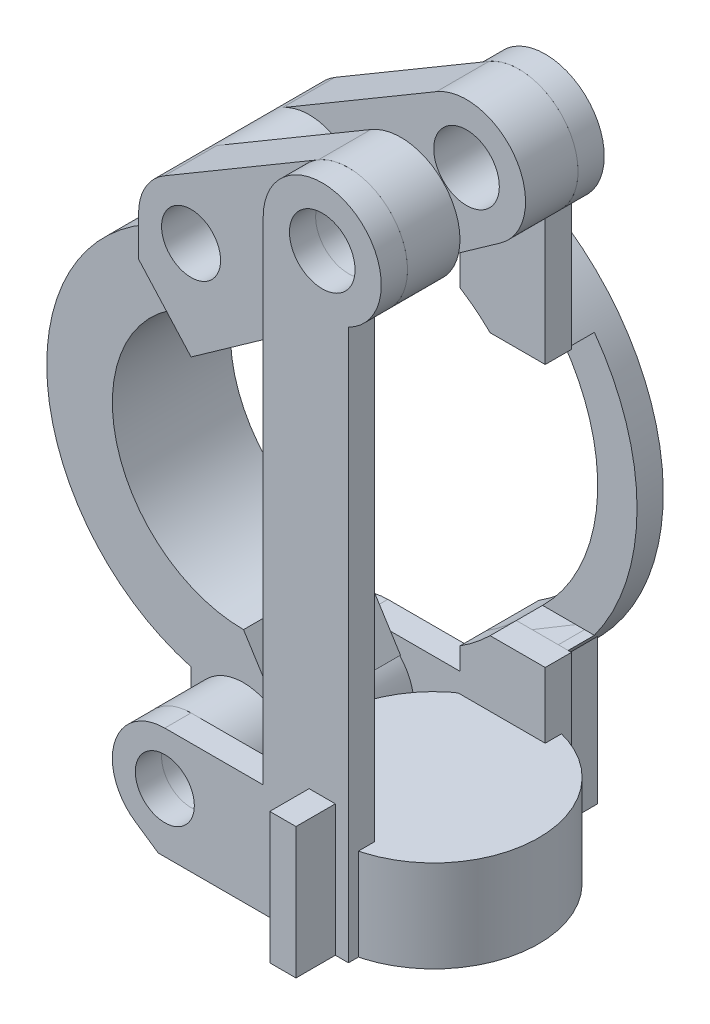
from build123d import *

# Parameters (mm, degrees)
SKETCH_1_R          = 2.25
SKETCH_1_R_2        = 2.5
EXTRUDE_1_DEPTH     = 4
SKETCH_2_R          = 2.25
EXTRUDE_2_DEPTH     = 5
SKETCH_5_R          = 2.25
SKETCH_5_R_2        = 4.5
SKETCH_5_R_3        = 2.5
EXTRUDE_3_DEPTH     = 4
SKETCH_6_R          = 2.5
SKETCH_6_R_2        = 2.25
EXTRUDE_6_DEPTH     = 2
SKETCH_6_3_R        = 4
SKETCH_6_3_R_2      = 2.25
EXTRUDE_8_DEPTH     = 4
SKETCH_7_R          = 2.5
SKETCH_7_R_2        = 2.25
EXTRUDE_9_DEPTH     = 2
CUT_EXTRUDE_1_DEPTH = 2
EXTRUDE_10_DEPTH    = 2
EXTRUDE_10_2_DEPTH  = 2
EXTRUDE_11_DEPTH    = 2
SKETCH_12_R         = 8
EXTRUDE_12_DEPTH    = 7
SKETCH_13_R         = 5.5
CUT_EXTRUDE_2_DEPTH = 5.1
SKETCH_14_W         = 2
SKETCH_14_H         = 10
EXTRUDE_13_DEPTH    = 3
SKETCH_15_W         = 2
SKETCH_15_H         = 12
EXTRUDE_14_DEPTH    = 3


with BuildPart() as part:
    # Эскиз1 → Бобышка-Вытянуть1 (new body)
    with BuildSketch(Plane.XY):
        with BuildLine():
            Line((-2.286801689, 3.875633888), (-14.032712613, -3.0549921))
            ThreePointArc((-14.032712613, -3.0549921), (-15.473532097, -4.516423741), (-16, -6.5))
            Line((-16, -6.5), (-16, -9.543167705))
            ThreePointArc((-16, -9.543167705), (-27, -24), (-16, -38.456832295))
            Line((-16, -38.456832295), (-16, -41.5))
            ThreePointArc((-16, -41.5), (-10.501613617, -45.208751575), (-9.122580876, -38.721428571))
            ThreePointArc((-9.122580876, -38.721428571), (-9.078403799, -38.712724956), (-9.034253047, -38.703888772))
            Line((-9.034253047, -38.703888772), (-12, -34))
            ThreePointArc((-12, -34), (-22, -24), (-12, -14))
            Line((-12, -14), (2.598641026, -3.673835165))
            ThreePointArc((2.598641026, -3.673835165), (3.777953373, 2.44480435), (-2.286801689, 3.875633888))
        make_face()
        with Locations((-12, -41.5)):
            Circle(SKETCH_1_R, mode=Mode.SUBTRACT)
        with Locations((-12, -6.5)):
            Circle(SKETCH_1_R, mode=Mode.SUBTRACT)
        Circle(SKETCH_1_R_2, mode=Mode.SUBTRACT)
    extrude(amount=EXTRUDE_1_DEPTH)

    # Эскиз2 → Бобышка-Вытянуть2 (add)
    # profile 1 of 2: a face of its own
    with BuildSketch(Plane.XY.offset(4)):
        with BuildLine():
            Line((-7.05186636, -10.5), (-8.088820948, -5.66174084))
            ThreePointArc((-8.088820948, -5.66174084), (-8.022267215, -6.078524147), (-8, -6.5))
            ThreePointArc((-8, -6.5), (-12, -10.5), (-16, -6.5))
            Line((-16, -6.5), (-16, -9.543167705))
            ThreePointArc((-16, -9.543167705), (-27, -24), (-16, -38.456832295))
            Line((-16, -38.456832295), (-16, -41.5))
            ThreePointArc((-16, -41.5), (-10.501613617, -45.208751575), (-9.122580876, -38.721428571))
            ThreePointArc((-9.122580876, -38.721428571), (-9.078403799, -38.712724956), (-9.034253047, -38.703888772))
            Line((-9.034253047, -38.703888772), (-12, -34))
            ThreePointArc((-12, -34), (-22, -24), (-12, -14))
            Line((-12, -14), (-7.05186636, -10.5))
        make_face()
        with Locations((-12, -41.5)):
            Circle(SKETCH_2_R, mode=Mode.SUBTRACT)
    # profile 2 of 2: a face of its own
    with BuildSketch(Plane.XY.offset(4)):
        with BuildLine():
            ThreePointArc((-8, -6.5), (-8.022267215, -6.078524147), (-8.088820948, -5.66174084))
            ThreePointArc((-8.088820948, -5.66174084), (-10.393468397, -2.836797001), (-14.032712613, -3.0549921))
            ThreePointArc((-14.032712613, -3.0549921), (-15.473532097, -4.516423741), (-16, -6.5))
            ThreePointArc((-16, -6.5), (-12, -10.5), (-8, -6.5))
        make_face()
        with Locations((-12, -6.5)):
            Circle(SKETCH_2_R, mode=Mode.SUBTRACT)
    extrude(amount=EXTRUDE_2_DEPTH)

    # Эскиз5 → Бобышка-Вытянуть3 (add)
    # profile 1 of 4: a face of its own
    with BuildSketch(Plane.XY.offset(9)):
        with BuildLine():
            Line((-2.286801689, 3.875633888), (-14.032712613, -3.0549921))
            ThreePointArc((-14.032712613, -3.0549921), (-10.393468397, -2.836797001), (-8.088820948, -5.66174084))
            Line((-8.088820948, -5.66174084), (-7.05186636, -10.5))
            Line((-7.05186636, -10.5), (2.598641026, -3.673835165))
            ThreePointArc((2.598641026, -3.673835165), (-3.777953373, -2.44480435), (-2.286801689, 3.875633888))
        make_face()
    # profile 2 of 4: a face of its own
    with BuildSketch(Plane.XY.offset(9)):
        with BuildLine():
            ThreePointArc((-8.088820948, -5.66174084), (-10.393468397, -2.836797001), (-14.032712613, -3.0549921))
            ThreePointArc((-14.032712613, -3.0549921), (-15.473532097, -4.516423741), (-16, -6.5))
            ThreePointArc((-16, -6.5), (-12, -10.5), (-8, -6.5))
            ThreePointArc((-8, -6.5), (-8.022267215, -6.078524147), (-8.088820948, -5.66174084))
        make_face()
        with Locations((-12, -6.5)):
            Circle(SKETCH_5_R, mode=Mode.SUBTRACT)
    # profile 3 of 4: a face of its own
    with BuildSketch(Plane.XY.offset(9)):
        with BuildLine():
            Line((-7.05186636, -10.5), (-8.088820948, -5.66174084))
            ThreePointArc((-8.088820948, -5.66174084), (-8.022267215, -6.078524147), (-8, -6.5))
            ThreePointArc((-8, -6.5), (-12, -10.5), (-16, -6.5))
            Line((-16, -6.5), (-16, -9.543167705))
            Line((-16, -9.543167705), (-12, -14))
            Line((-12, -14), (-7.05186636, -10.5))
        make_face()
    # profile 4 of 4: a face of its own
    with BuildSketch(Plane.XY.offset(9)):
        Circle(SKETCH_5_R_2)
        Circle(SKETCH_5_R_3, mode=Mode.SUBTRACT)
    extrude(amount=EXTRUDE_3_DEPTH)


with BuildPart() as body_2:
    # Эскиз6 → Бобышка-Вытянуть6 (new body)
    with BuildSketch(Plane.XY.offset(13)):
        with BuildLine():
            ThreePointArc((2, -4.031128874), (2.371708245, 3.824264635), (-4.5, 0))
            Line((-4.5, 0), (-4.5, -37.5))
            Line((-4.5, -37.5), (-12, -37.5))
            ThreePointArc((-12, -37.5), (-15.822364985, -40.321218459), (-14.252866643, -44.80523704))
            Line((-14.252866643, -44.80523704), (-12.5, -46))
            Line((-12.5, -46), (2, -46))
            Line((2, -46), (2, -4.031128874))
        make_face()
        Circle(SKETCH_6_R, mode=Mode.SUBTRACT)
        with Locations((-12, -41.5)):
            Circle(SKETCH_6_R_2, mode=Mode.SUBTRACT)
    extrude(amount=EXTRUDE_6_DEPTH)


with BuildPart() as body_3:
    # Эскиз6<3> → Бобышка-Вытянуть8 (new body)
    with BuildSketch(Plane.XY.offset(13)):
        with Locations((-12, -41.5)):
            Circle(SKETCH_6_3_R)
        with Locations((-12, -41.5)):
            Circle(SKETCH_6_3_R_2, mode=Mode.SUBTRACT)
    extrude(amount=-EXTRUDE_8_DEPTH)


with BuildPart() as body_4:
    # Эскиз7 → Бобышка-Вытянуть9 (new body)
    with BuildSketch(Plane(origin=(0, 0, 0), x_dir=(-1, 0, 0), z_dir=(0, 0, -1))):
        with BuildLine():
            ThreePointArc((4.5, 0), (-2.371708245, 3.824264635), (-2, -4.031128874))
            Line((-2, -4.031128874), (-2, -46))
            Line((-2, -46), (12.5, -46))
            Line((12.5, -46), (14.252866643, -44.80523704))
            ThreePointArc((14.252866643, -44.80523704), (15.822364985, -40.321218459), (12, -37.5))
            Line((12, -37.5), (4.5, -37.5))
            Line((4.5, -37.5), (4.5, 0))
        make_face()
        Circle(SKETCH_7_R, mode=Mode.SUBTRACT)
        with Locations((12, -41.5)):
            Circle(SKETCH_7_R_2, mode=Mode.SUBTRACT)
    extrude(amount=EXTRUDE_9_DEPTH)

    # Эскиз9 → Вырез-Вытянуть1 (cut)
    with BuildSketch(Plane(origin=(0, 0, -2), x_dir=(-1, 0, 0), z_dir=(0, 0, -1))):
        with BuildLine():
            ThreePointArc((4.5, -12.178409582), (3.303196331, -13.028873989), (2.202041029, -14))
            ThreePointArc((2.202041029, -14), (-0.906808777, -18.576505997), (-2, -24))
            ThreePointArc((-2, -24), (-0.906808777, -29.423494003), (2.202041029, -34))
            ThreePointArc((2.202041029, -34), (3.303196331, -34.971126011), (4.5, -35.821590418))
            Line((4.5, -35.821590418), (4.5, -12.178409582))
        make_face()
        with BuildLine():
            Line((2.202041029, -14), (-2, -14))
            Line((-2, -14), (-2, -24))
            ThreePointArc((-2, -24), (-0.906808777, -18.576505997), (2.202041029, -14))
        make_face()
        with BuildLine():
            ThreePointArc((2.202041029, -34), (-0.906808777, -29.423494003), (-2, -24))
            Line((-2, -24), (-2, -34))
            Line((-2, -34), (2.202041029, -34))
        make_face()
    extrude(amount=-CUT_EXTRUDE_1_DEPTH, mode=Mode.SUBTRACT)


with BuildPart() as cut_extrude_1_piece_1:
    # of the separate pieces the step leaves, piece 1, a body of its own (cut_extrude_1_pieces)
    add(body_4.part.solids().sort_by_distance((-12, -37.5, 0))[0])


with BuildPart() as cut_extrude_1_piece_2:
    # of the separate pieces the step leaves, piece 2, a body of its own (cut_extrude_1_pieces)
    add(body_4.part.solids().sort_by_distance((-4.5, -12.178409582, 0))[0])


with BuildPart() as body_6:
    # Эскиз10 → Бобышка-Вытянуть10 (new body)
    with BuildSketch(Plane(origin=(0, 0, -2), x_dir=(-1, 0, 0), z_dir=(0, 0, -1))):
        with BuildLine():
            Line((1.66801084, -37.5), (4.5, -37.5))
            Line((4.5, -37.5), (4.5, -35.821590418))
            ThreePointArc((4.5, -35.821590418), (3.303196331, -34.971126011), (2.202041029, -34))
            Line((2.202041029, -34), (-1.747727085, -34))
            ThreePointArc((-1.747727085, -34), (-0.166375122, -35.873471118), (1.66801084, -37.5))
        make_face()
    extrude(amount=EXTRUDE_10_DEPTH)



with BuildPart() as body_7:
    # Эскиз10 → Extrude 10 2 (new body)
    with BuildSketch(Plane(origin=(0, 0, -2), x_dir=(-1, 0, 0), z_dir=(0, 0, -1))):
        with BuildLine():
            ThreePointArc((4.5, -8.743853698), (1.055903644, -10.99128158), (-1.747727085, -14))
            Line((-1.747727085, -14), (2.202041029, -14))
            ThreePointArc((2.202041029, -14), (3.303196331, -13.028873989), (4.5, -12.178409582))
            Line((4.5, -12.178409582), (4.5, -8.743853698))
        make_face()
    extrude(amount=EXTRUDE_10_2_DEPTH)


with BuildPart() as body_6_1:
    add(body_6.part)

    add(body_7.part)  # Бобышка-Вытянуть11 merges body 7
    # Эскиз11 → Бобышка-Вытянуть11 (add)
    with BuildSketch(Plane(origin=(0, 0, -4), x_dir=(-1, 0, 0), z_dir=(0, 0, -1))):
        with BuildLine():
            ThreePointArc((2.202041029, -14), (3.303196331, -13.028873989), (4.5, -12.178409582))
            Line((4.5, -12.178409582), (4.5, -8.743853698))
            ThreePointArc((4.5, -8.743853698), (1.055903644, -10.99128158), (-1.747727085, -14))
            Line((-1.747727085, -14), (2.202041029, -14))
        make_face()
        with BuildLine():
            Line((2.202041029, -14), (-1.747727085, -14))
            ThreePointArc((-1.747727085, -14), (-4.823218586, -26.445264074), (1.66801084, -37.5))
            Line((1.66801084, -37.5), (4.5, -37.5))
            Line((4.5, -37.5), (4.5, -35.821590418))
            ThreePointArc((4.5, -35.821590418), (-1.92301326, -25.466186131), (2.202041029, -14))
        make_face()
    extrude(amount=EXTRUDE_11_DEPTH)


with BuildPart() as body_7_2:
    # Эскиз12 → Бобышка-Вытянуть12 (new body)
    with BuildSketch(Plane.XZ.offset(46)):
        with Locations(Location((0, 6.5, 0), (0, 0, 270))):
            Circle(SKETCH_12_R)
    extrude(amount=-EXTRUDE_12_DEPTH)

    # Эскиз13 → Вырез-Вытянуть2 (cut)
    with BuildSketch(Plane.XZ.offset(46)):
        with Locations(Location((0, 6.5, 0), (0, 0, 270))):
            Circle(SKETCH_13_R)
    extrude(amount=-CUT_EXTRUDE_2_DEPTH, mode=Mode.SUBTRACT)


with BuildPart() as body_8:
    # Эскиз14 → Бобышка-Вытянуть13 (new body)
    with BuildSketch(Plane.XY.offset(15)):
        with Locations((0, -41)):
            Rectangle(SKETCH_14_W, SKETCH_14_H)
    extrude(amount=EXTRUDE_13_DEPTH)


with BuildPart() as body_9:
    # Эскиз15 → Бобышка-Вытянуть14 (new body)
    with BuildSketch(Plane(origin=(0, 0, -2), x_dir=(-1, 0, 0), z_dir=(0, 0, -1))):
        with Locations((0, -40)):
            Rectangle(SKETCH_15_W, SKETCH_15_H)
    extrude(amount=EXTRUDE_14_DEPTH)


solid = Compound([part.part, body_2.part, body_3.part, cut_extrude_1_piece_1.part, cut_extrude_1_piece_2.part, body_6_1.part, body_7_2.part, body_8.part, body_9.part])
